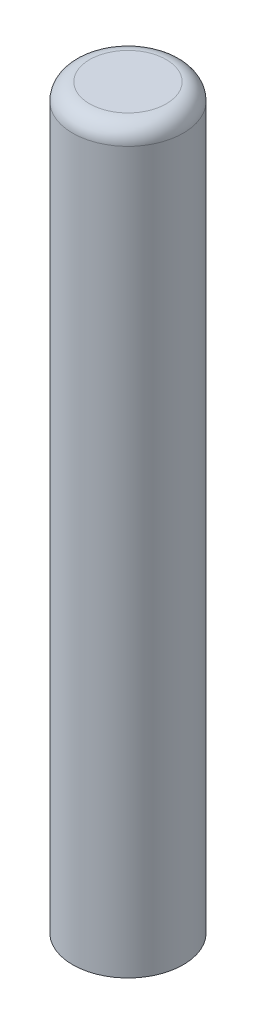
from build123d import *

# Parameters (mm, degrees)
SKETCH1_R       = 7.5
MAIN_BODY_DEPTH = 100
FILLET1_R       = 2.3


with BuildPart() as part:
    # Sketch1 → Main Body (new body)
    with BuildSketch(Plane(origin=(0, 0, 0), x_dir=(1, 0, 0), z_dir=(0, 1, 0))):
        with Locations(Location((0, 0, 0), (0, 0, 270))):
            Circle(SKETCH1_R)
    extrude(amount=MAIN_BODY_DEPTH)

    # Fillet1
    fillet1_edges = [part.edges().sort_by_distance(p)[0] for p in [
        (0, 100, -7.5),
    ]]
    fillet(fillet1_edges, radius=FILLET1_R)


solid = part.part
